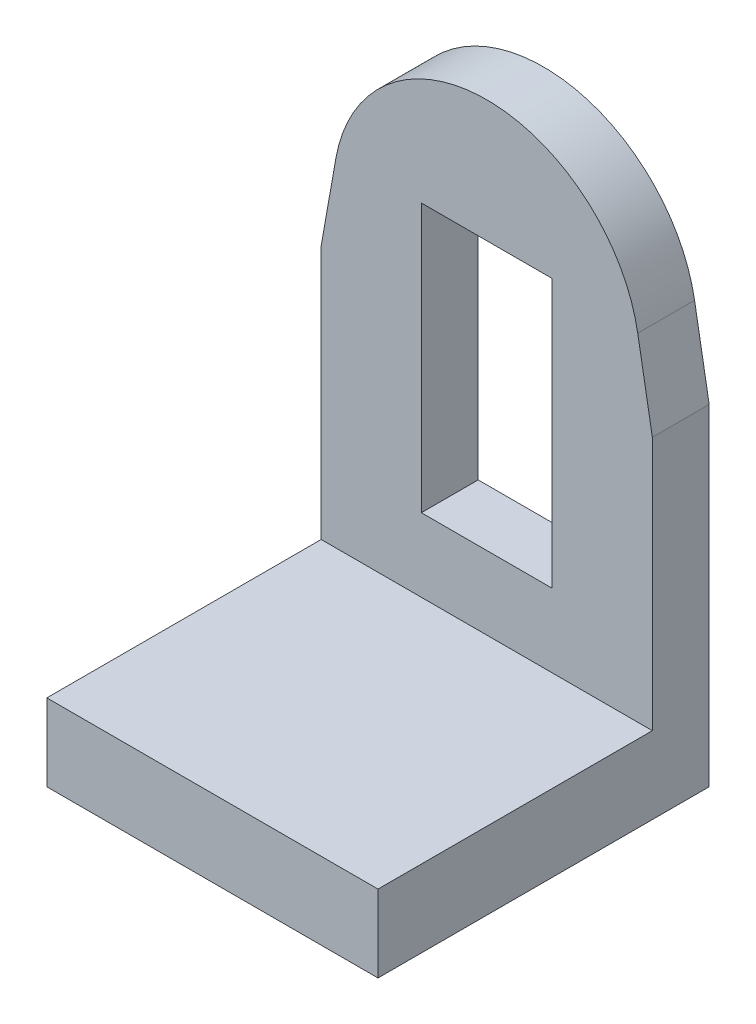
from build123d import *

# Parameters (mm, degrees)
BOSS_EXTRUDE2_DEPTH      = 25.4
BOSS_EXTRUDE2_DEPTH_BACK = 25.4
SKETCH5_W                = 55.996028866
SKETCH5_H                = 43.041519522
CUT_EXTRUDE2_DEPTH       = 71.12
CUT_EXTRUDE4_REACH       = 104.359
SKETCH8_W                = 20.066
SKETCH8_H                = 41.148


with BuildPart() as part:
    # Sketch3 → Boss-Extrude2 (new, two sides: drawn at the far end of the back side and taken through both)
    with BuildSketch(Plane.XY.offset(-BOSS_EXTRUDE2_DEPTH_BACK)):
        with BuildLine():
            Line((-31.917133282, 0), (18.882866718, 0))
            Line((18.882866718, 0), (18.882866718, 50.8))
            Line((18.882866718, 50.8), (16.643514063, 63.5))
            ThreePointArc((16.643514063, 63.5), (-6.517133282, 82.934090645), (-29.677780627, 63.5))
            Line((-29.677780627, 63.5), (-31.917133282, 50.8))
            Line((-31.917133282, 50.8), (-31.917133282, 0))
        make_face()
    extrude(amount=BOSS_EXTRUDE2_DEPTH + BOSS_EXTRUDE2_DEPTH_BACK)

    # Sketch5 → Cut-Extrude2 (cut)
    with BuildSketch(Plane(origin=(0, 82.934090645, 0), x_dir=(1, 0, 0), z_dir=(0, 1, 0))):
        with Locations((-7.030712477, -4.838222216)):
            Rectangle(SKETCH5_W, SKETCH5_H)
    extrude(amount=-CUT_EXTRUDE2_DEPTH, mode=Mode.SUBTRACT)

    # Sketch8 → Cut-Extrude4 (cut, up to next)
    with BuildSketch(Plane.XY.offset(25.4), mode=Mode.PRIVATE) as cut_extrude4_sk1:
        with Locations((-6.517133282, 43.625792805)):
            Rectangle(SKETCH8_W, SKETCH8_H)
    cut_extrude4_tool1 = extrude(cut_extrude4_sk1.sketch, amount=-CUT_EXTRUDE4_REACH, mode=Mode.PRIVATE) & part.part
    add(cut_extrude4_tool1.solids().sort_by_distance((-6.517133, 43.625793, 25.4))[0], mode=Mode.SUBTRACT)


solid = part.part
